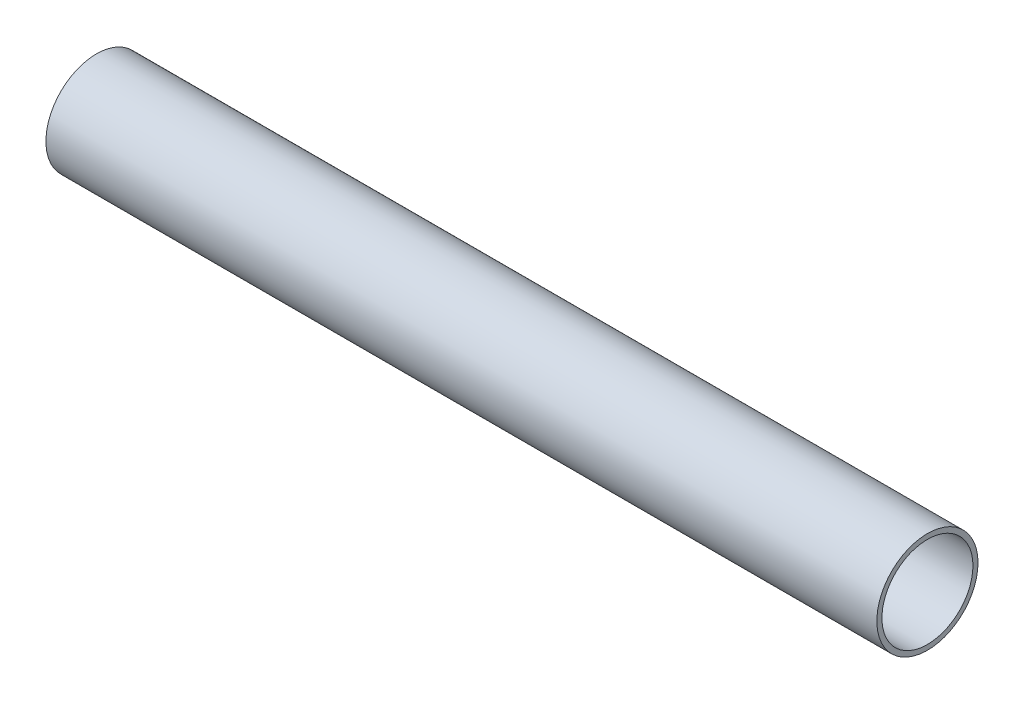
from build123d import *

# Parameters (mm, degrees)
SKETCH1_R           = 15.875
SKETCH1_R_2         = 14.2875
EXTRUDE_THIN1_DEPTH = 130.4000059


with BuildPart() as part:
    # Sketch1 → Extrude-Thin1 (new, symmetric)
    with BuildSketch(Plane(origin=(0, 0, 0), x_dir=(0, 0, -1), z_dir=(1, 0, 0))):
        Circle(SKETCH1_R)
        Circle(SKETCH1_R_2, mode=Mode.SUBTRACT)
    extrude(amount=EXTRUDE_THIN1_DEPTH, both=True)


solid = part.part
